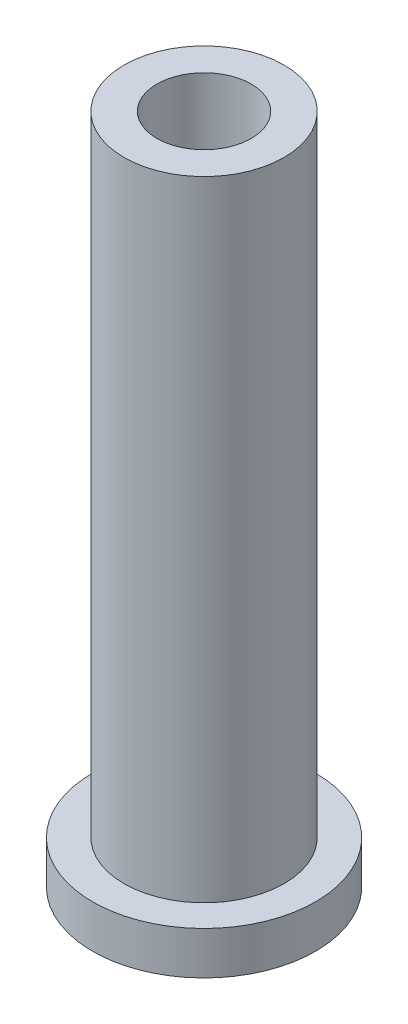
from build123d import *


with BuildPart() as part:
    # Reconstructed nominal axial profile → Native revolved geometry (revolve)
    with BuildSketch(Plane.XY, mode=Mode.PRIVATE) as native_revolved_geometry_sk:
        Polygon((1.65, -1.5), (1.65, 22), (2.8, 22), (2.8, 0), (3.9, 0), (3.9, -1.5), align=None)
    revolve(native_revolved_geometry_sk.sketch.rotate(Axis((0, -500, 0), (0, 1, 0)), 90), axis=Axis((0, -500, 0), (0, 1, 0)))


solid = part.part
